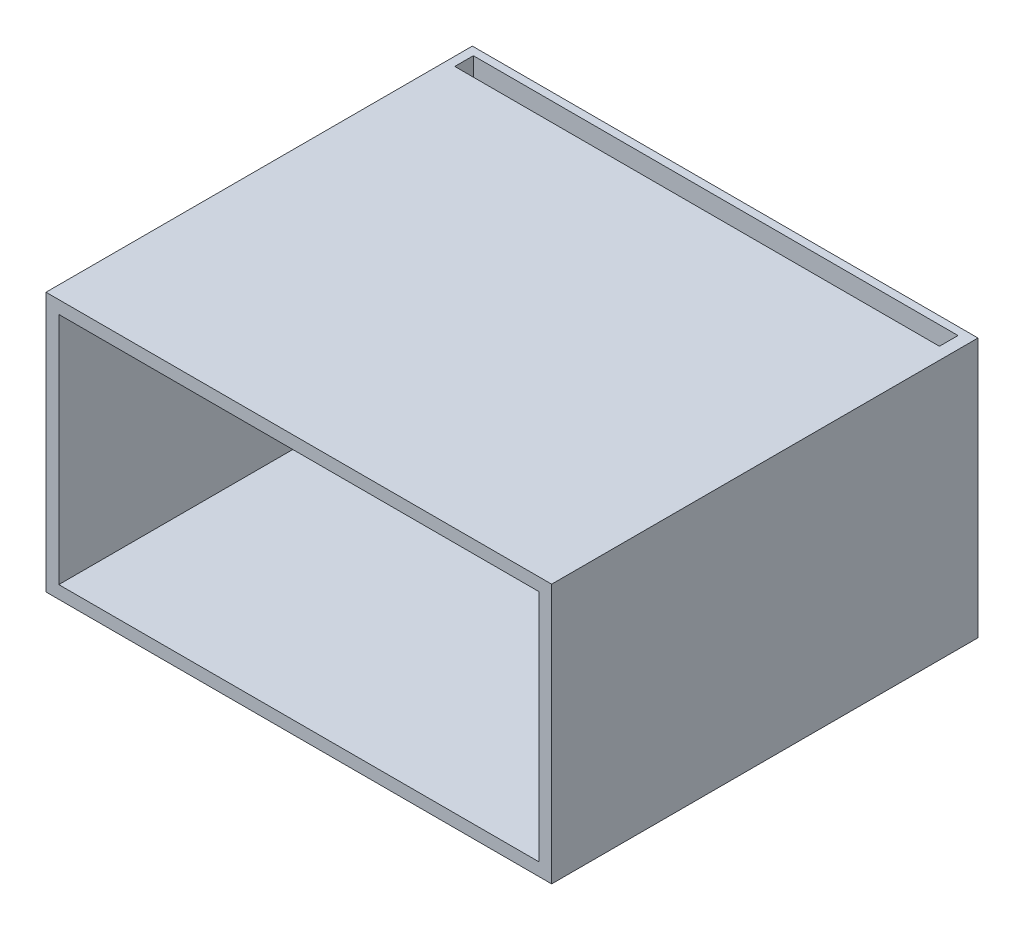
from build123d import *

# Parameters (mm, degrees)
SKETCH1_W           = 394.926652775
SKETCH1_H           = 202.769674437
BOSS_EXTRUDE1_DEPTH = 333
SHELL5_T            = -10
BOSS_EXTRUDE2_DEPTH = 7
SKETCH19_R          = 24.92303726
CUT_EXTRUDE1_DEPTH  = 14
BOSS_EXTRUDE3_DEPTH = 7
SKETCH23_R          = 24.92303726
CUT_EXTRUDE2_DEPTH  = 14
SKETCH24_W          = 378.549978472
SKETCH24_H          = 14.5311901
CUT_EXTRUDE6_DEPTH  = 30
SKETCH25_W          = 25.994787148
SKETCH25_H          = 10.885886146
BOSS_EXTRUDE5_DEPTH = 14
SKETCH27_W          = 29.478735589
SKETCH27_H          = 14.140745891
BOSS_EXTRUDE7_DEPTH = 14
EXTRUDE_THIN2_REACH = 553.377
SKETCH33_W          = 10
SKETCH33_H          = 122.071459974
CUT_EXTRUDE8_DEPTH  = 49
SKETCH35_W          = 10
SKETCH35_H          = 10.654236951
CUT_EXTRUDE11_DEPTH = 182.769674437


with BuildPart() as part:
    # Sketch1 → Boss-Extrude1 (new body)
    with BuildSketch(Plane.XY):
        with Locations((197.463326388, 101.384837219)):
            Rectangle(SKETCH1_W, SKETCH1_H)
    extrude(amount=BOSS_EXTRUDE1_DEPTH)

    # Shell5
    shell5_openings = [part.faces().sort_by_distance(p)[0] for p in [
        (197.463326387, 101.384837219, 333),
    ]]
    offset(amount=SHELL5_T, openings=shell5_openings, kind=Kind.INTERSECTION)

    # Sketch18 → Boss-Extrude2 (add, symmetric)
    with BuildSketch(Plane.XY.offset(166.5)):
        with BuildLine():
            Line((10, 128.355944405), (81.814439739, 128.355944405))
            ThreePointArc((81.814439739, 128.355944405), (117.012291579, 93.158092565), (81.814439739, 57.960240724))
            Line((81.814439739, 57.960240724), (10, 57.960240724))
            Line((10, 57.960240724), (10, 128.355944405))
        make_face()
    extrude(amount=BOSS_EXTRUDE2_DEPTH, both=True)

    # Sketch19 → Cut-Extrude1 (cut)
    with BuildSketch(Plane.XY.offset(173.5)):
        with Locations((81.814439739, 93.158092565)):
            Circle(SKETCH19_R)
    extrude(amount=-CUT_EXTRUDE1_DEPTH, mode=Mode.SUBTRACT)

    # Sketch22 → Boss-Extrude3 (add, symmetric)
    with BuildSketch(Plane.XY.offset(166.5)):
        with BuildLine():
            Line((384.926652775, 128.355944405), (291.108955259, 128.355944405))
            ThreePointArc((291.108955259, 128.355944405), (256.621992249, 93.868981396), (291.108955259, 59.382018386))
            Line((291.108955259, 59.382018386), (384.926652775, 59.382018386))
            Line((384.926652775, 59.382018386), (384.926652775, 128.355944405))
        make_face()
    extrude(amount=BOSS_EXTRUDE3_DEPTH, both=True)

    # Sketch23 → Cut-Extrude2 (cut)
    with BuildSketch(Plane.XY.offset(173.5)):
        with Locations((291.108955259, 93.868981396)):
            Circle(SKETCH23_R)
    extrude(amount=-CUT_EXTRUDE2_DEPTH, mode=Mode.SUBTRACT)

    # Sketch24 → Cut-Extrude6 (cut)
    with BuildSketch(Plane(origin=(0, 202.769674437, 0), x_dir=(1, 0, 0), z_dir=(0, 1, 0))):
        with Locations((196.17510715, -13.388641901)):
            Rectangle(SKETCH24_W, SKETCH24_H)
    extrude(amount=-CUT_EXTRUDE6_DEPTH, mode=Mode.SUBTRACT)

    # Sketch25 → Boss-Extrude5 (add)
    with BuildSketch(Plane(origin=(0, 10, 0), x_dir=(1, 0, 0), z_dir=(0, 1, 0))):
        with Locations((19.897511488, -26.097180024)):
            Rectangle(SKETCH25_W, SKETCH25_H)
    extrude(amount=BOSS_EXTRUDE5_DEPTH)

    # Sketch27 → Boss-Extrude7 (add)
    with BuildSketch(Plane(origin=(0, 10, 0), x_dir=(1, 0, 0), z_dir=(0, 1, 0))):
        with Locations((370.710728592, -27.724609897)):
            Rectangle(SKETCH27_W, SKETCH27_H)
    extrude(amount=BOSS_EXTRUDE7_DEPTH)

    # Sketch33 → Extrude-Thin2 (add, up to next)
    with BuildSketch(Plane.XZ.offset(-192.769674437), mode=Mode.PRIVATE) as extrude_thin2_sk1:
        with Locations((202.463326387, 71.035729987)):
            Rectangle(SKETCH33_W, SKETCH33_H)
    extrude_thin2_tool1 = extrude(extrude_thin2_sk1.sketch, amount=EXTRUDE_THIN2_REACH, mode=Mode.PRIVATE) - part.part
    add(extrude_thin2_tool1.solids().sort_by_distance((202.463326, 192.769674, 71.03573))[0])

    # Sketch34 → Cut-Extrude8 (cut)
    with BuildSketch(Plane.ZY.offset(-197.463326387)):
        Polygon((132.071459974, 58.157894262), (39.515170412, 10), (132.071459974, 10), align=None)
    extrude(amount=-CUT_EXTRUDE8_DEPTH, mode=Mode.SUBTRACT)

    # Sketch35 → Cut-Extrude11 (cut)
    with BuildSketch(Plane(origin=(0, 192.769674437, 0), x_dir=(1, 0, 0), z_dir=(0, 1, 0))):
        with Locations((202.463326387, -15.327118476)):
            Rectangle(SKETCH35_W, SKETCH35_H)
    extrude(amount=-CUT_EXTRUDE11_DEPTH, mode=Mode.SUBTRACT)


solid = part.part
